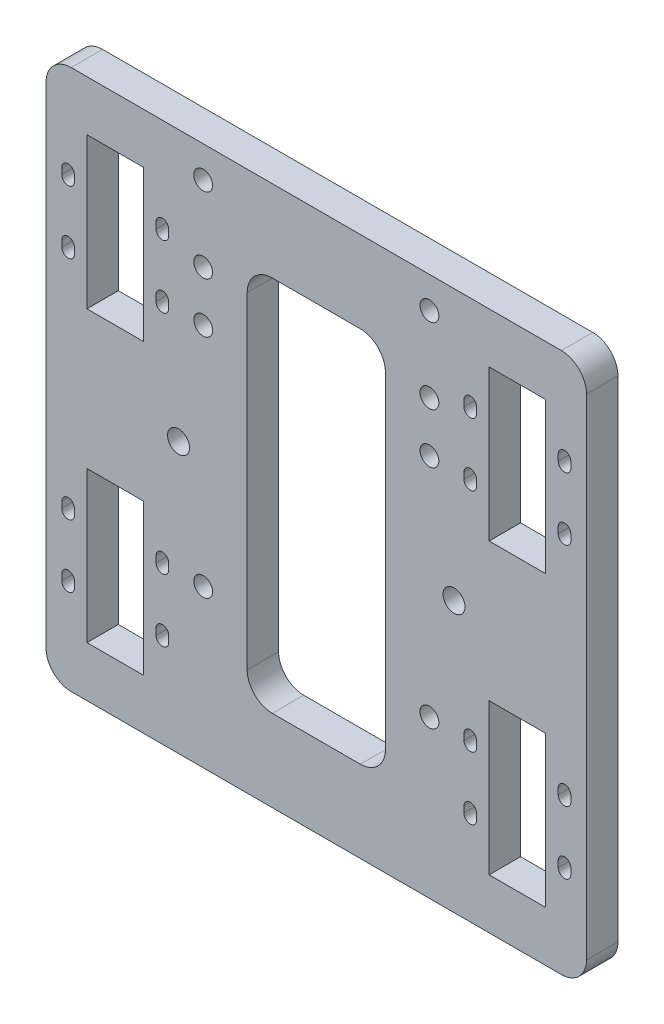
from build123d import *

# Parameters (mm, degrees)
SKETCH1_W           = 86
SKETCH1_H           = 86
SKETCH1_R           = 1.5
SKETCH1_R_2         = 1.75
SKETCH1_W_2         = 9
SKETCH1_H_2         = 24
SKETCH1_W_3         = 22
SKETCH1_H_3         = 60
BOSS_EXTRUDE1_DEPTH = 5
FILLET1_R           = 4


with BuildPart() as part:
    # Sketch1 → Boss-Extrude1 (new body)
    with BuildSketch(Plane.XY):
        with Locations((43, 43)):
            Rectangle(SKETCH1_W, SKETCH1_H)
        with Locations((25, 61)):
            Circle(SKETCH1_R, mode=Mode.SUBTRACT)
        with Locations((61, 61)):
            Circle(SKETCH1_R, mode=Mode.SUBTRACT)
        with Locations((61, 25)):
            Circle(SKETCH1_R, mode=Mode.SUBTRACT)
        with Locations((25, 25)):
            Circle(SKETCH1_R, mode=Mode.SUBTRACT)
        with Locations((25, 81)):
            Circle(SKETCH1_R, mode=Mode.SUBTRACT)
        with Locations(Location((25, 69, 0), (0, 0, 180))):
            Circle(SKETCH1_R, mode=Mode.SUBTRACT)
        with Locations((61, 69)):
            Circle(SKETCH1_R, mode=Mode.SUBTRACT)
        with Locations(Location((61, 81, 0), (0, 0, 180))):
            Circle(SKETCH1_R, mode=Mode.SUBTRACT)
        with Locations((64.920310217, 43)):
            Circle(SKETCH1_R_2, mode=Mode.SUBTRACT)
        with Locations((21.079689783, 43)):
            Circle(SKETCH1_R_2, mode=Mode.SUBTRACT)
        with Locations((75, 66)):
            Rectangle(SKETCH1_W_2, SKETCH1_H_2, mode=Mode.SUBTRACT)
        with BuildLine():
            Line((68.5, 61.5), (68.5, 60.5))
            ThreePointArc((68.5, 60.5), (67.5, 59.5), (66.5, 60.5))
            Line((66.5, 60.5), (66.5, 61.5))
            ThreePointArc((66.5, 61.5), (67.5, 62.5), (68.5, 61.5))
        make_face(mode=Mode.SUBTRACT)
        with BuildLine():
            Line((81.5, 61.5), (81.5, 60.5))
            ThreePointArc((81.5, 60.5), (82.5, 59.5), (83.5, 60.5))
            Line((83.5, 60.5), (83.5, 61.5))
            ThreePointArc((83.5, 61.5), (82.5, 62.5), (81.5, 61.5))
        make_face(mode=Mode.SUBTRACT)
        with BuildLine():
            Line((68.5, 24.5), (68.5, 25.5))
            ThreePointArc((68.5, 25.5), (67.5, 26.5), (66.5, 25.5))
            Line((66.5, 25.5), (66.5, 24.5))
            ThreePointArc((66.5, 24.5), (67.5, 23.5), (68.5, 24.5))
        make_face(mode=Mode.SUBTRACT)
        with BuildLine():
            Line((81.5, 24.5), (81.5, 25.5))
            ThreePointArc((81.5, 25.5), (82.5, 26.5), (83.5, 25.5))
            Line((83.5, 25.5), (83.5, 24.5))
            ThreePointArc((83.5, 24.5), (82.5, 23.5), (81.5, 24.5))
        make_face(mode=Mode.SUBTRACT)
        with Locations((75, 20)):
            Rectangle(SKETCH1_W_2, SKETCH1_H_2, mode=Mode.SUBTRACT)
        with BuildLine():
            Line((17.5, 61.5), (17.5, 60.5))
            ThreePointArc((17.5, 60.5), (18.5, 59.5), (19.5, 60.5))
            Line((19.5, 60.5), (19.5, 61.5))
            ThreePointArc((19.5, 61.5), (18.5, 62.5), (17.5, 61.5))
        make_face(mode=Mode.SUBTRACT)
        with BuildLine():
            Line((4.5, 61.5), (4.5, 60.5))
            ThreePointArc((4.5, 60.5), (3.5, 59.5), (2.5, 60.5))
            Line((2.5, 60.5), (2.5, 61.5))
            ThreePointArc((2.5, 61.5), (3.5, 62.5), (4.5, 61.5))
        make_face(mode=Mode.SUBTRACT)
        with BuildLine():
            Line((17.5, 24.5), (17.5, 25.5))
            ThreePointArc((17.5, 25.5), (18.5, 26.5), (19.5, 25.5))
            Line((19.5, 25.5), (19.5, 24.5))
            ThreePointArc((19.5, 24.5), (18.5, 23.5), (17.5, 24.5))
        make_face(mode=Mode.SUBTRACT)
        with BuildLine():
            Line((4.5, 24.5), (4.5, 25.5))
            ThreePointArc((4.5, 25.5), (3.5, 26.5), (2.5, 25.5))
            Line((2.5, 25.5), (2.5, 24.5))
            ThreePointArc((2.5, 24.5), (3.5, 23.5), (4.5, 24.5))
        make_face(mode=Mode.SUBTRACT)
        with Locations((11, 20)):
            Rectangle(SKETCH1_W_2, SKETCH1_H_2, mode=Mode.SUBTRACT)
        with Locations((11, 66)):
            Rectangle(SKETCH1_W_2, SKETCH1_H_2, mode=Mode.SUBTRACT)
        with Locations((43, 43)):
            Rectangle(SKETCH1_W_3, SKETCH1_H_3, mode=Mode.SUBTRACT)
        with BuildLine():
            Line((68.5, 70.5), (68.5, 71.5))
            ThreePointArc((68.5, 71.5), (67.5, 72.5), (66.5, 71.5))
            Line((66.5, 71.5), (66.5, 70.5))
            ThreePointArc((66.5, 70.5), (67.5, 69.5), (68.5, 70.5))
        make_face(mode=Mode.SUBTRACT)
        with BuildLine():
            Line((81.5, 70.5), (81.5, 71.5))
            ThreePointArc((81.5, 71.5), (82.5, 72.5), (83.5, 71.5))
            Line((83.5, 71.5), (83.5, 70.5))
            ThreePointArc((83.5, 70.5), (82.5, 69.5), (81.5, 70.5))
        make_face(mode=Mode.SUBTRACT)
        with BuildLine():
            Line((17.5, 70.5), (17.5, 71.5))
            ThreePointArc((17.5, 71.5), (18.5, 72.5), (19.5, 71.5))
            Line((19.5, 71.5), (19.5, 70.5))
            ThreePointArc((19.5, 70.5), (18.5, 69.5), (17.5, 70.5))
        make_face(mode=Mode.SUBTRACT)
        with BuildLine():
            Line((4.5, 70.5), (4.5, 71.5))
            ThreePointArc((4.5, 71.5), (3.5, 72.5), (2.5, 71.5))
            Line((2.5, 71.5), (2.5, 70.5))
            ThreePointArc((2.5, 70.5), (3.5, 69.5), (4.5, 70.5))
        make_face(mode=Mode.SUBTRACT)
        with BuildLine():
            Line((4.5, 15.5), (4.5, 14.5))
            ThreePointArc((4.5, 14.5), (3.5, 13.5), (2.5, 14.5))
            Line((2.5, 14.5), (2.5, 15.5))
            ThreePointArc((2.5, 15.5), (3.5, 16.5), (4.5, 15.5))
        make_face(mode=Mode.SUBTRACT)
        with BuildLine():
            Line((17.5, 15.5), (17.5, 14.5))
            ThreePointArc((17.5, 14.5), (18.5, 13.5), (19.5, 14.5))
            Line((19.5, 14.5), (19.5, 15.5))
            ThreePointArc((19.5, 15.5), (18.5, 16.5), (17.5, 15.5))
        make_face(mode=Mode.SUBTRACT)
        with BuildLine():
            Line((68.5, 15.5), (68.5, 14.5))
            ThreePointArc((68.5, 14.5), (67.5, 13.5), (66.5, 14.5))
            Line((66.5, 14.5), (66.5, 15.5))
            ThreePointArc((66.5, 15.5), (67.5, 16.5), (68.5, 15.5))
        make_face(mode=Mode.SUBTRACT)
        with BuildLine():
            Line((81.5, 15.5), (81.5, 14.5))
            ThreePointArc((81.5, 14.5), (82.5, 13.5), (83.5, 14.5))
            Line((83.5, 14.5), (83.5, 15.5))
            ThreePointArc((83.5, 15.5), (82.5, 16.5), (81.5, 15.5))
        make_face(mode=Mode.SUBTRACT)
    extrude(amount=BOSS_EXTRUDE1_DEPTH)

    # Fillet1
    fillet1_edges = [part.edges().sort_by_distance(p)[0] for p in [
        (32, 73, 2.5),
        (32, 13, 2.5),
        (54, 13, 2.5),
        (54, 73, 2.5),
        (0, 86, 2.5),
        (86, 86, 2.5),
        (86, 0, 2.5),
        (0, 0, 2.5),
    ]]
    fillet(fillet1_edges, radius=FILLET1_R)


solid = part.part
